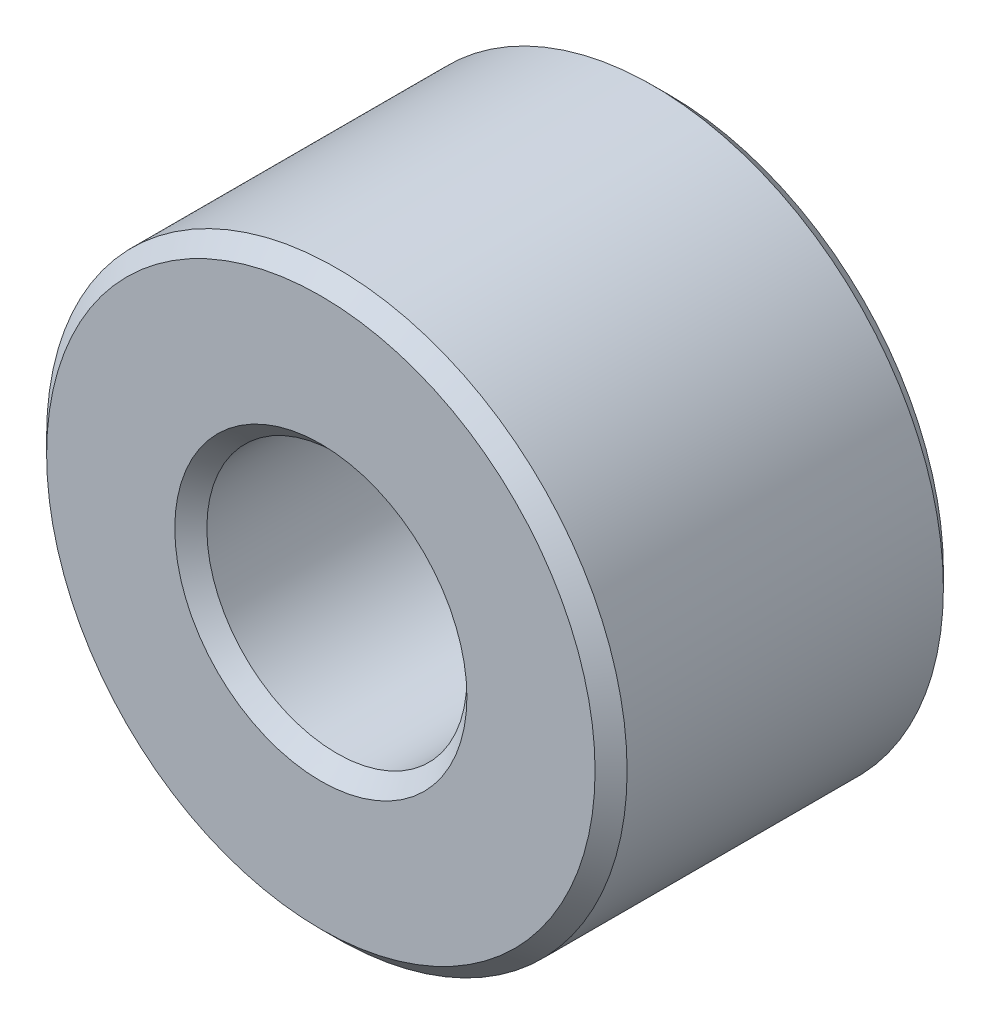
from build123d import *

# Parameters (mm, degrees)
BOSS_EXTRUDE1_DEPTH      = 2.38125
BOSS_EXTRUDE1_DEPTH_BACK = 2.38125
SKETCH3_R                = 3.96875
SKETCH3_R_2              = 1.778
CHAMFER1_SIZE            = 0.219075


with BuildPart() as part:
    # Sketch3 → Boss-Extrude1 (new, two sides: drawn at the far end of the back side and taken through both)
    with BuildSketch(Plane.XY.offset(-BOSS_EXTRUDE1_DEPTH_BACK)):
        Circle(SKETCH3_R)
        Circle(SKETCH3_R_2, mode=Mode.SUBTRACT)
    extrude(amount=BOSS_EXTRUDE1_DEPTH + BOSS_EXTRUDE1_DEPTH_BACK)

    # Chamfer1
    chamfer1_edges = [part.edges().sort_by_distance(p)[0] for p in [
        (-3.96875, 0, -2.38125),
        (-1.778, 0, -2.38125),
        (-3.96875, 0, 2.38125),
        (-1.778, 0, 2.38125),
    ]]
    chamfer(chamfer1_edges, length=CHAMFER1_SIZE)


solid = part.part
